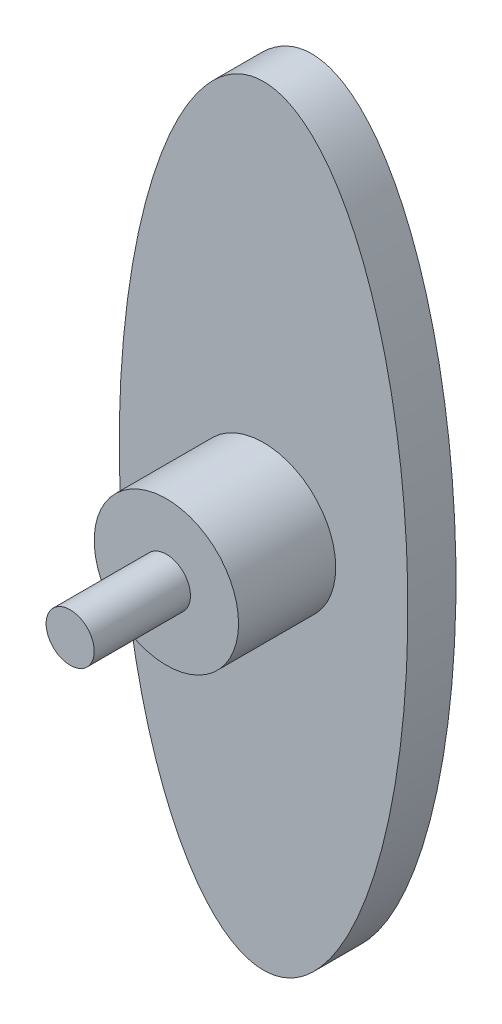
from build123d import *

# Parameters (mm, degrees)
SKETCH1_RX          = 50.8
SKETCH1_RY          = 19.05
BOSS_EXTRUDE1_DEPTH = 3.175
SKETCH2_R           = 9.525
BOSS_EXTRUDE2_DEPTH = 16.002
SKETCH3_R           = 3.175
BOSS_EXTRUDE3_DEPTH = 28.702


with BuildPart() as part:
    # Sketch1 → Boss-Extrude1 (new, symmetric)
    with BuildSketch(Plane.XY):
        with Locations(Location((0, 0), (0, 0, -90))):
            Ellipse(SKETCH1_RX, SKETCH1_RY)
    extrude(amount=BOSS_EXTRUDE1_DEPTH, both=True)

    # Sketch2 → Boss-Extrude2 (add)
    with BuildSketch(Plane.XY):
        Circle(SKETCH2_R)
    extrude(amount=BOSS_EXTRUDE2_DEPTH)

    # Sketch3 → Boss-Extrude3 (add)
    with BuildSketch(Plane.XY):
        Circle(SKETCH3_R)
    extrude(amount=BOSS_EXTRUDE3_DEPTH)


solid = part.part
